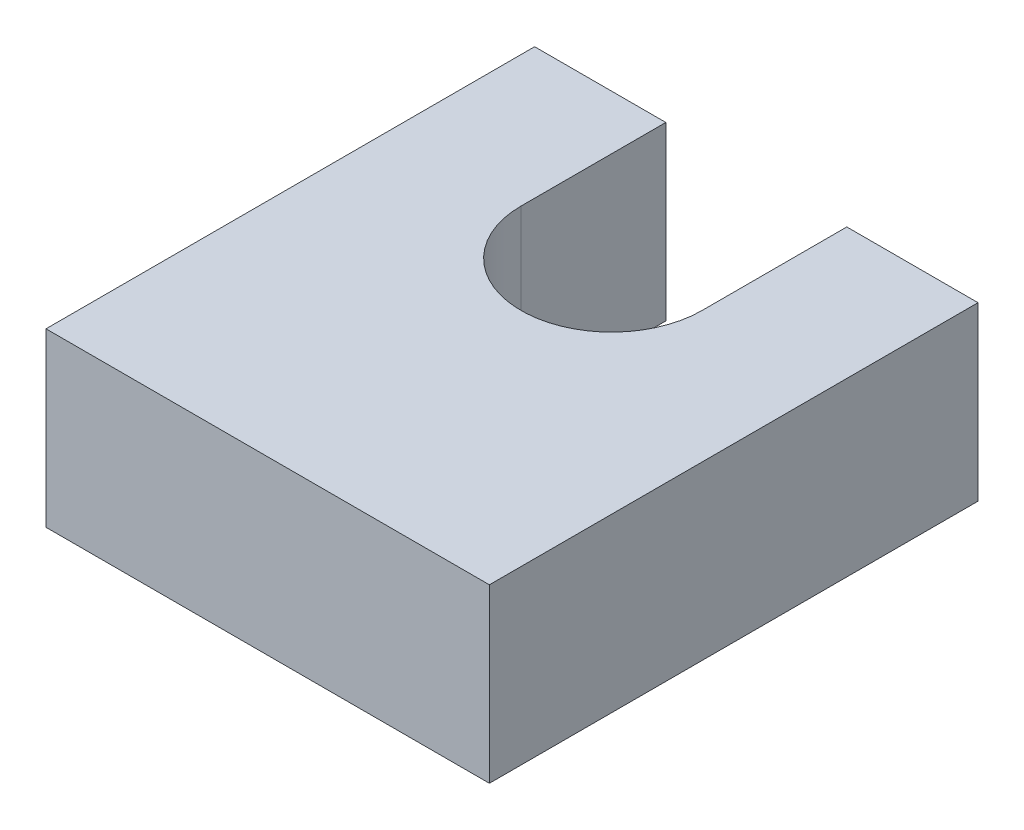
from build123d import *

# Parameters (mm, degrees)
DODANIE_WYCI_GNI_CIE1_DEPTH = 9.5


with BuildPart() as part:
    # Szkic1 → Dodanie-wyciągnięcie1 (new body)
    with BuildSketch(Plane(origin=(0, 0, 0), x_dir=(1, 0, 0), z_dir=(0, 1, 0))):
        with BuildLine():
            ThreePointArc((5, 0), (0, -5), (-5, 0))
            Line((-5, 0), (-5, 8))
            Line((-5, 8), (-12.25, 8))
            Line((-12.25, 8), (-12.25, -19))
            Line((-12.25, -19), (12.25, -19))
            Line((12.25, -19), (12.25, 8))
            Line((12.25, 8), (5, 8))
            Line((5, 8), (5, 0))
        make_face()
    extrude(amount=DODANIE_WYCI_GNI_CIE1_DEPTH)


solid = part.part
